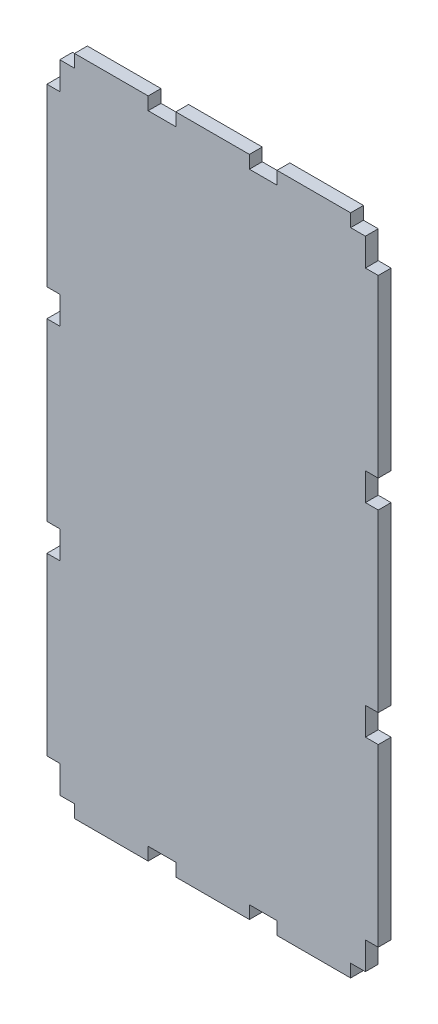
from build123d import *

# Parameters (mm, degrees)
BASE_SKETCH_W           = 304.8
BASE_SKETCH_H           = 609.6
BOSS_EXTRUDE1_DEPTH     = 11.81
JOINT_X_W               = 25.4
JOINT_X_H               = 11.81
CUT_EXTRUDE1_DEPTH      = 341.981342745
LPATTERN1_COUNT         = 4
LPATTERN1_PITCH         = 93.133333333
MIRROR1_COPY_1_SKETCH_W = 25.4
MIRROR1_COPY_1_SKETCH_H = 11.81
MIRROR1_COPY_1_DEPTH    = 341.981342745
MIRROR1_COPY_2_SKETCH_W = 25.4
MIRROR1_COPY_2_SKETCH_H = 11.81
MIRROR1_COPY_2_DEPTH    = 341.981342745
MIRROR1_COPY_3_SKETCH_W = 25.4
MIRROR1_COPY_3_SKETCH_H = 11.81
MIRROR1_COPY_3_DEPTH    = 341.981342745
JOINT_Y_W               = 11.81
JOINT_Y_H               = 25.4
CUT_EXTRUDE2_DEPTH      = 341.981342745
LPATTERN3_COUNT         = 4
LPATTERN3_PITCH         = 186.86
MIRROR4_COPY_1_SKETCH_W = 11.81
MIRROR4_COPY_1_SKETCH_H = 25.4
MIRROR4_COPY_1_DEPTH    = 341.981342745
MIRROR4_COPY_2_SKETCH_W = 11.81
MIRROR4_COPY_2_SKETCH_H = 25.4
MIRROR4_COPY_2_DEPTH    = 341.981342745
MIRROR4_COPY_3_SKETCH_W = 11.81
MIRROR4_COPY_3_SKETCH_H = 25.4
MIRROR4_COPY_3_DEPTH    = 341.981342745


with BuildPart() as part:
    # Base_Sketch → Boss-Extrude1 (new body)
    with BuildSketch(Plane.XY):
        Rectangle(BASE_SKETCH_W, BASE_SKETCH_H)
    extrude(amount=BOSS_EXTRUDE1_DEPTH)

    # Joint_X → Cut-Extrude1 (cut, through all)
    with BuildSketch(Plane.XY.offset(11.81)):
        with Locations((-139.7, -298.895)):
            Rectangle(JOINT_X_W, JOINT_X_H)
    cut_extrude1 = extrude(amount=-CUT_EXTRUDE1_DEPTH, mode=Mode.SUBTRACT)

    # LPattern1: Cut-Extrude1 ×4
    with Locations(*[(i * LPATTERN1_PITCH, 0, 0) for i in range(1, LPATTERN1_COUNT)]):
        add(cut_extrude1, mode=Mode.SUBTRACT)

    # Mirror1: Cut-Extrude1 across plane
    add(cut_extrude1.mirror(Plane.ZX), mode=Mode.SUBTRACT)

    # Mirror1 copy 1 sketch → Mirror1 copy 1 (cut, through all)
    with BuildSketch(Plane(origin=(93.133333333, 0, 11.81), x_dir=(1, 0, 0), z_dir=(0, 0, 1))):
        with Locations((-139.7, 298.895)):
            Rectangle(MIRROR1_COPY_1_SKETCH_W, MIRROR1_COPY_1_SKETCH_H)
    extrude(amount=-MIRROR1_COPY_1_DEPTH, mode=Mode.SUBTRACT)

    # Mirror1 copy 2 sketch → Mirror1 copy 2 (cut, through all)
    with BuildSketch(Plane(origin=(186.266666667, 0, 11.81), x_dir=(1, 0, 0), z_dir=(0, 0, 1))):
        with Locations((-139.7, 298.895)):
            Rectangle(MIRROR1_COPY_2_SKETCH_W, MIRROR1_COPY_2_SKETCH_H)
    extrude(amount=-MIRROR1_COPY_2_DEPTH, mode=Mode.SUBTRACT)

    # Mirror1 copy 3 sketch → Mirror1 copy 3 (cut, through all)
    with BuildSketch(Plane(origin=(279.4, 0, 11.81), x_dir=(1, 0, 0), z_dir=(0, 0, 1))):
        with Locations((-139.7, 298.895)):
            Rectangle(MIRROR1_COPY_3_SKETCH_W, MIRROR1_COPY_3_SKETCH_H)
    extrude(amount=-MIRROR1_COPY_3_DEPTH, mode=Mode.SUBTRACT)

    # Joint_Y → Cut-Extrude2 (cut, through all)
    with BuildSketch(Plane.XY.offset(11.81)):
        with Locations((-146.495, -280.29)):
            Rectangle(JOINT_Y_W, JOINT_Y_H)
    cut_extrude2 = extrude(amount=-CUT_EXTRUDE2_DEPTH, mode=Mode.SUBTRACT)

    # LPattern3: Cut-Extrude2 ×4
    with Locations(*[(0, i * LPATTERN3_PITCH, 0) for i in range(1, LPATTERN3_COUNT)]):
        add(cut_extrude2, mode=Mode.SUBTRACT)

    # Mirror4: Cut-Extrude2 across plane
    add(cut_extrude2.mirror(Plane(origin=(0, 0, 0), x_dir=(0, 0, 1), z_dir=(1, 0, 0))), mode=Mode.SUBTRACT)

    # Mirror4 copy 1 sketch → Mirror4 copy 1 (cut, through all)
    with BuildSketch(Plane(origin=(0, 186.86, 11.81), x_dir=(-1, 0, 0), z_dir=(0, 0, 1))):
        with Locations((-146.495, 280.29)):
            Rectangle(MIRROR4_COPY_1_SKETCH_W, MIRROR4_COPY_1_SKETCH_H)
    extrude(amount=-MIRROR4_COPY_1_DEPTH, mode=Mode.SUBTRACT)

    # Mirror4 copy 2 sketch → Mirror4 copy 2 (cut, through all)
    with BuildSketch(Plane(origin=(0, 373.72, 11.81), x_dir=(-1, 0, 0), z_dir=(0, 0, 1))):
        with Locations((-146.495, 280.29)):
            Rectangle(MIRROR4_COPY_2_SKETCH_W, MIRROR4_COPY_2_SKETCH_H)
    extrude(amount=-MIRROR4_COPY_2_DEPTH, mode=Mode.SUBTRACT)

    # Mirror4 copy 3 sketch → Mirror4 copy 3 (cut, through all)
    with BuildSketch(Plane(origin=(0, 560.58, 11.81), x_dir=(-1, 0, 0), z_dir=(0, 0, 1))):
        with Locations((-146.495, 280.29)):
            Rectangle(MIRROR4_COPY_3_SKETCH_W, MIRROR4_COPY_3_SKETCH_H)
    extrude(amount=-MIRROR4_COPY_3_DEPTH, mode=Mode.SUBTRACT)


solid = part.part
